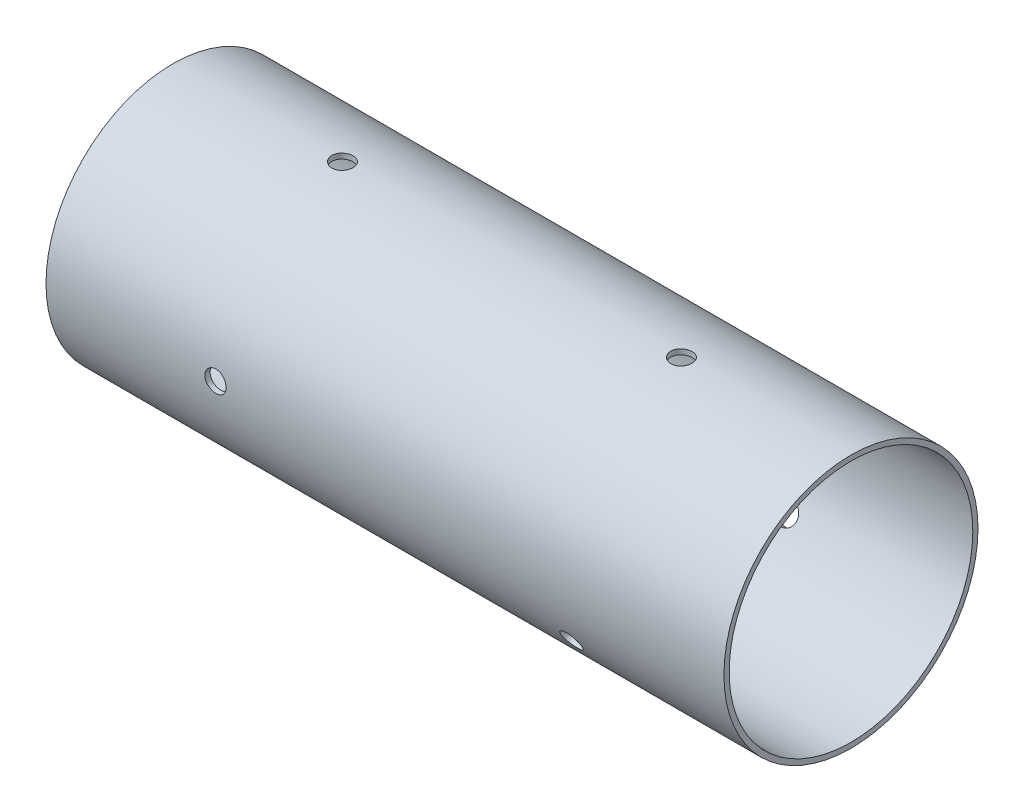
from build123d import *

# Parameters (mm, degrees)
SKETCH1_R           = 38.0746
SKETCH1_R_2         = 36.5125
BOSS_EXTRUDE1_DEPTH = 203.2
SKETCH2_R           = 3.175
CUT_EXTRUDE1_DEPTH  = 211.213202084
CIRPATTERN1_COUNT   = 4
SKETCH3_R           = 3.175
CUT_EXTRUDE2_DEPTH  = 211.213202217
CIRPATTERN2_COUNT   = 3


with BuildPart() as part:
    # Sketch1 → Boss-Extrude1 (new body)
    with BuildSketch(Plane.YZ):
        with Locations(Location((0, 0, 0), (0, 0, 270))):
            Circle(SKETCH1_R)
        with Locations(Location((0, 0, 0), (0, 0, 270))):
            Circle(SKETCH1_R_2, mode=Mode.SUBTRACT)
    extrude(amount=BOSS_EXTRUDE1_DEPTH)

    # Sketch2 → Cut-Extrude1 (cut, through all)
    with BuildSketch(Plane(origin=(0, 0, 0), x_dir=(-1, 0, 0), z_dir=(0, 1, 0))):
        with Locations(Location((-50.8, 0, 0), (0, 0, 270))):
            Circle(SKETCH2_R)
    cut_extrude1 = extrude(amount=CUT_EXTRUDE1_DEPTH, mode=Mode.SUBTRACT)

    # CirPattern1: Cut-Extrude1 ×4 about axis
    cirpattern1_axis = Axis((203.2, 0, 0), (-1, 0, 0))
    for i in range(1, CIRPATTERN1_COUNT):
        add(cut_extrude1.rotate(cirpattern1_axis, i * 360 / CIRPATTERN1_COUNT), mode=Mode.SUBTRACT)

    # Sketch3 → Cut-Extrude2 (cut, through all)
    with BuildSketch(Plane(origin=(0, 0, 0), x_dir=(-1, 0, 0), z_dir=(0, 1, 0))):
        with Locations(Location((-152.4, 0, 0), (0, 0, 270))):
            Circle(SKETCH3_R)
    cut_extrude2 = extrude(amount=CUT_EXTRUDE2_DEPTH, mode=Mode.SUBTRACT)

    # CirPattern2: Cut-Extrude2 ×3 about axis
    cirpattern2_axis = Axis((203.2, 0, 0), (-1, 0, 0))
    for i in range(1, CIRPATTERN2_COUNT):
        add(cut_extrude2.rotate(cirpattern2_axis, i * 360 / CIRPATTERN2_COUNT), mode=Mode.SUBTRACT)


solid = part.part
